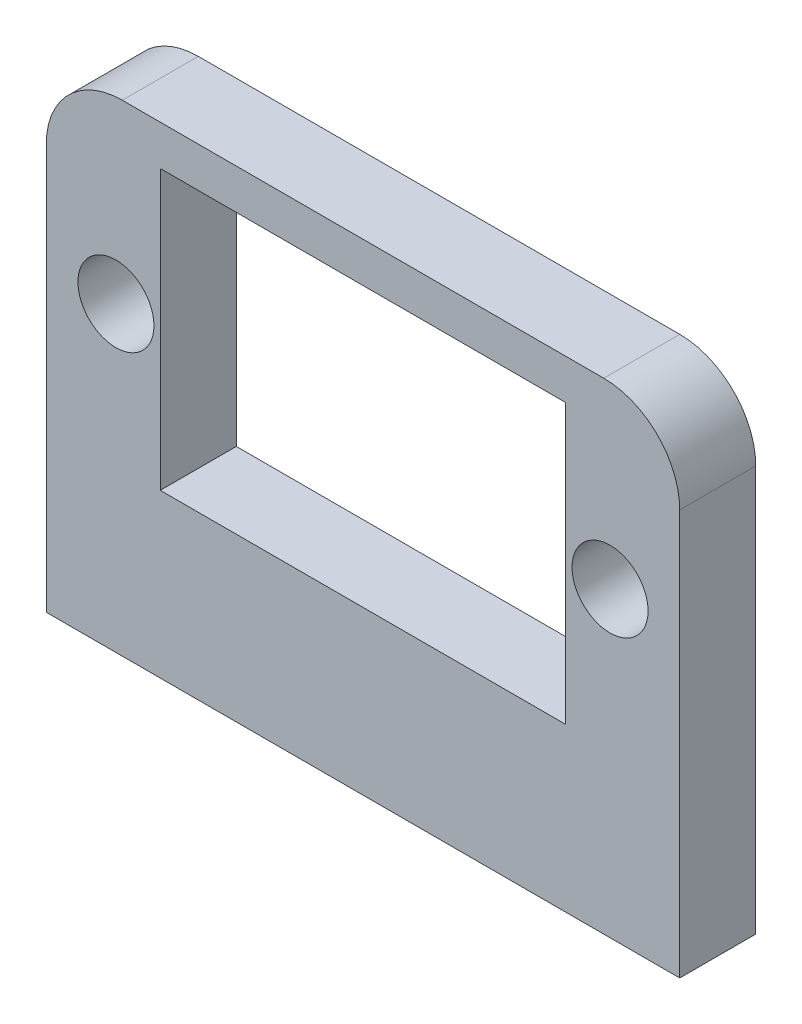
from build123d import *

# Parameters (mm, degrees)
BOSS_EXTRUDE1_DEPTH     = 2
SCALE1_SCALE            = 2
SKETCH6_R               = 1.5
CUT_EXTRUDE2_DEPTH      = 3
SKETCH7_W               = 25
SKETCH7_H               = 3
BOSS_EXTRUDE2_DEPTH     = 15
SKETCH8_R               = 1.5
SKETCH8_W               = 16
SKETCH8_H               = 11
CUT_EXTRUDE3_DEPTH      = 18
FILLET3_R               = 3
FILLET4_R               = 3
SKETCH10_R              = 1.5
CUT_EXTRUDE4_DEPTH      = 10
CUT_EXTRUDE5_DEPTH      = 52.533558907
CUT_EXTRUDE5_DEPTH_BACK = 52.533558907
SKETCH11_R              = 44.440054466
SKETCH11_W              = 25
SKETCH11_H              = 3


with BuildPart() as part:
    # Sketch2 → Boss-Extrude1 (new body)
    with BuildSketch(Plane(origin=(0, 0, 0), x_dir=(1, 0, 0), z_dir=(0, 1, 0))):
        with BuildLine():
            Line((-17.967387551, 9.159795774), (-20.639475337, 7.15016677))
            ThreePointArc((-20.639475337, 7.15016677), (-18.649238809, 4.17439457), (-19.346117765, 0.662896123))
            ThreePointArc((-19.346117765, 0.662896123), (-19.45411943, -1.286546543), (-18.558961711, -3.021678736))
            ThreePointArc((-18.558961711, -3.021678736), (-16.421478173, -5.190969631), (-13.78312899, -6.712078584))
            ThreePointArc((-13.78312899, -6.712078584), (-13.032173848, -6.916004841), (-12.276686285, -7.102440046))
            ThreePointArc((-12.276686285, -7.102440046), (-12.194265553, -8.245293076), (-11.737308023, -9.296052821))
            ThreePointArc((-11.737308023, -9.296052821), (-10.975506649, -9.937799505), (-10.090124565, -10.394175126))
            Line((-10.090124565, -10.394175126), (-7.391598262, -11.698651137))
            Line((-7.391598262, -11.698651137), (7.391598262, -11.698651137))
            Line((7.391598262, -11.698651137), (10.090124565, -10.394175126))
            ThreePointArc((10.090124565, -10.394175126), (10.975506649, -9.937799505), (11.737308023, -9.296052821))
            ThreePointArc((11.737308023, -9.296052821), (12.194265553, -8.245293076), (12.276686285, -7.102440046))
            ThreePointArc((12.276686285, -7.102440046), (13.032173848, -6.916004841), (13.78312899, -6.712078584))
            ThreePointArc((13.78312899, -6.712078584), (16.421478173, -5.190969631), (18.558961711, -3.021678736))
            ThreePointArc((18.558961711, -3.021678736), (19.45411943, -1.286546543), (19.346117765, 0.662896123))
            ThreePointArc((19.346117765, 0.662896123), (18.649238809, 4.17439457), (20.639475337, 7.15016677))
            Line((20.639475337, 7.15016677), (17.967387551, 9.159795774))
            ThreePointArc((17.967387551, 9.159795774), (10.858325227, 7.499674132), (4.169484372, 10.424426945))
            Line((4.169484372, 10.424426945), (2.224138848, 10.424426945))
            Line((2.224138848, 10.424426945), (0.696104526, 13.114793475))
            Line((0.696104526, 13.114793475), (0, 13.358013588))
            Line((0, 13.358013588), (-0.696104526, 13.114793475))
            Line((-0.696104526, 13.114793475), (-2.224138848, 10.424426945))
            Line((-2.224138848, 10.424426945), (-4.169484372, 10.424426945))
            ThreePointArc((-4.169484372, 10.424426945), (-10.858325227, 7.499674132), (-17.967387551, 9.159795774))
        make_face()
    extrude(amount=BOSS_EXTRUDE1_DEPTH)


with BuildPart() as part_1:
    # Scale1: scaled about (0, 1, 0.242383844)
    add(part.part.scale(SCALE1_SCALE).moved(Location((0, -1, -0.242383844))))

    # Sketch6 → Cut-Extrude2 (cut)
    with BuildSketch(Plane(origin=(0, 3, 0), x_dir=(1, 0, 0), z_dir=(0, 1, 0))):
        with Locations(Location((-5.851533015, 16.28357055, 0), (0, 0, 270))):
            Circle(SKETCH6_R)
        with Locations(Location((4.151829214, 16.28357055, 0), (0, 0, 270))):
            Circle(SKETCH6_R)
    extrude(amount=-CUT_EXTRUDE2_DEPTH, mode=Mode.SUBTRACT)

    # Sketch7 → Boss-Extrude2 (add)
    with BuildSketch(Plane(origin=(0, 3, 0), x_dir=(1, 0, 0), z_dir=(0, 1, 0))):
        with Locations((0, 11.610861671)):
            Rectangle(SKETCH7_W, SKETCH7_H)
    extrude(amount=BOSS_EXTRUDE2_DEPTH)

    # Sketch8 → Cut-Extrude3 (cut)
    with BuildSketch(Plane.XY.offset(-10.110861671)):
        with Locations((-9.75, 10.917386914)):
            Circle(SKETCH8_R)
        with Locations((9.75, 10.917386914)):
            Circle(SKETCH8_R)
        with Locations((0, 10.917386914)):
            Rectangle(SKETCH8_W, SKETCH8_H)
    extrude(amount=-CUT_EXTRUDE3_DEPTH, mode=Mode.SUBTRACT)

    # Fillet3
    fillet3_edges = [part_1.edges().sort_by_distance(p)[0] for p in [
        (-12.5, 18, -11.610861671),
    ]]
    fillet(fillet3_edges, radius=FILLET3_R)

    # Fillet4
    fillet4_edges = [part_1.edges().sort_by_distance(p)[0] for p in [
        (12.5, 18, -11.610861671),
    ]]
    fillet(fillet4_edges, radius=FILLET4_R)

    # Sketch10 → Cut-Extrude4 (cut)
    with BuildSketch(Plane(origin=(0, 3, 0), x_dir=(1, 0, 0), z_dir=(0, 1, 0))):
        with Locations(Location((-0.8498519, -20.895328087, 0), (0, 0, 270))):
            Circle(SKETCH10_R)
    extrude(amount=-CUT_EXTRUDE4_DEPTH, mode=Mode.SUBTRACT)

    # Sketch11 → Cut-Extrude5 (cut, two sides: drawn at the far end of the back side and taken through both)
    with BuildSketch(Plane(origin=(0, 3, 0), x_dir=(1, 0, 0), z_dir=(0, 1, 0)).offset(-CUT_EXTRUDE5_DEPTH_BACK)):
        Circle(SKETCH11_R)
        with Locations((0, 11.610861671)):
            Rectangle(SKETCH11_W, SKETCH11_H, mode=Mode.SUBTRACT)
    extrude(amount=CUT_EXTRUDE5_DEPTH + CUT_EXTRUDE5_DEPTH_BACK, mode=Mode.SUBTRACT)


solid = part_1.part
